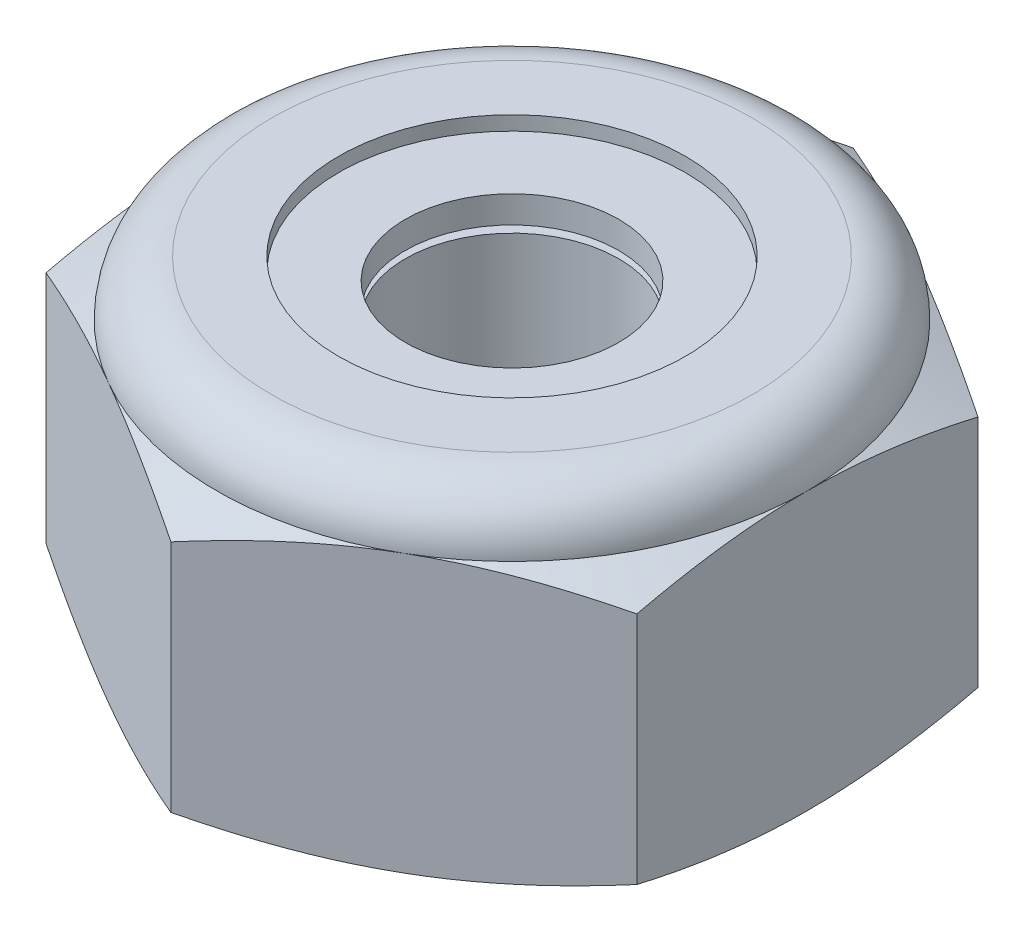
from build123d import *

# Parameters (mm, degrees)
EXTRUDE1_DEPTH = 3.571875


with BuildPart() as part:
    # Sketch1 → Extrude1 (new body)
    with BuildSketch(Plane(origin=(0, 0, 0), x_dir=(1, 0, 0), z_dir=(0, 1, 0))):
        Polygon((0, 3.666174209), (-3.175, 1.833087105), (-3.175, -1.833087105), (0, -3.666174209), (3.175, -1.833087105), (3.175, 1.833087105), align=None)
    extrude(amount=EXTRUDE1_DEPTH)

    # Sketch4 → Cut-Revolve2 (revolve, cut)
    with BuildSketch(Plane(origin=(0, 0, 0), x_dir=(0, 0, -1), z_dir=(1, 0, 0))):
        Polygon((0, 3.571875), (1.4224, 3.571875), (1.147473702, 3.443674762), (1.147473702, 0.128200238), (1.4224, 0), (0, 0), align=None)
    revolve(axis=Axis((0, 3.571875, 0), (0, 1, 0)), mode=Mode.SUBTRACT)

    # Sketch5 → Cut-Revolve3 (revolve, cut)
    with BuildSketch(Plane(origin=(0, 0, 0), x_dir=(0, 0, -1), z_dir=(1, 0, 0))):
        with BuildLine():
            Line((0, 0), (3.175, 0))
            Line((3.175, 0), (3.666174209, 0.229038295))
            Line((3.666174209, 0.229038295), (3.666174209, 2.747524205))
            Line((3.666174209, 2.747524205), (3.175, 2.9765625))
            ThreePointArc((3.175, 2.9765625), (3.000637006, 3.397512006), (2.5796875, 3.571875))
            Line((2.5796875, 3.571875), (2.5796875, 4.841875))
            Line((2.5796875, 4.841875), (4.936174209, 4.841875))
            Line((4.936174209, 4.841875), (4.936174209, -1.27))
            Line((4.936174209, -1.27), (0, -1.27))
            Line((0, -1.27), (0, 0))
        make_face()
    revolve(axis=Axis((0, 0, 0), (0, 1, 0)), mode=Mode.SUBTRACT)

    # Sketch6 → Cut-Revolve4 (revolve, cut)
    with BuildSketch(Plane(origin=(0, 0, 0), x_dir=(0, 0, -1), z_dir=(1, 0, 0))):
        with BuildLine():
            Line((1.147473702, 2.9765625), (3.0226, 2.9765625))
            ThreePointArc((3.0226, 2.9765625), (2.892873932, 3.289748932), (2.5796875, 3.419475))
            Line((2.5796875, 3.419475), (1.863580601, 3.419475))
            Line((1.863580601, 3.419475), (1.863580601, 4.841875))
            Line((1.863580601, 4.841875), (1.147473702, 4.841875))
            Line((1.147473702, 4.841875), (1.147473702, 2.9765625))
        make_face()
    revolve(axis=Axis((0, 0, 0), (0, 1, 0)), mode=Mode.SUBTRACT)


with BuildPart() as body_2:
    # Sketch7 → Revolve2 (revolve)
    with BuildSketch(Plane(origin=(0, 0, 0), x_dir=(0, 0, -1), z_dir=(1, 0, 0))):
        with BuildLine():
            Line((1.147473702, 3.0527625), (2.938395763, 3.0527625))
            ThreePointArc((2.938395763, 3.0527625), (2.810484559, 3.261537543), (2.5796875, 3.343275))
            Line((2.5796875, 3.343275), (1.147473702, 3.343275))
            Line((1.147473702, 3.343275), (1.147473702, 3.0527625))
        make_face()
    revolve(axis=Axis((0, 3.0527625, 0), (0, 1, 0)))


solid = Compound([part.part, body_2.part])
